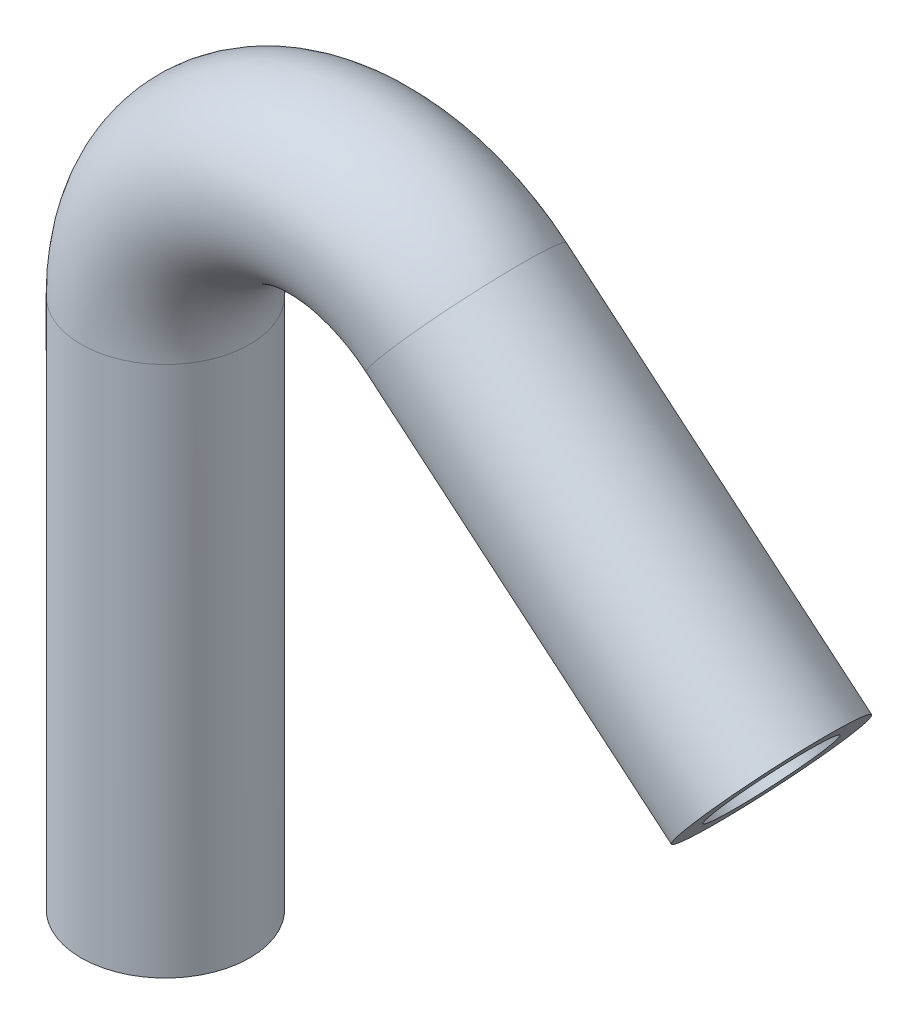
from build123d import *

# Parameters (mm, degrees)
SWEEP_SOTTILE1_PROFILE_R   = 3.175
SWEEP_SOTTILE1_PROFILE_R_2 = 2.175


with BuildPart() as part:
    # Sweep-Sottile1: sweep along a path in Schizzo1
    with BuildLine(Plane.XY) as sweep_sottile1_path:
        Line((0, 0), (0, 20))
        ThreePointArc((0, 20), (3.980067207, 26.247454091), (11.324232584, 25.280576377))
        Line((11.324232584, 25.280576377), (22.81489923, 15.638762231))
    # Sweep-Sottile1 profile (on start of the path) → Sweep-Sottile1 (sweep)
    with BuildSketch(Plane.ZX):
        Circle(SWEEP_SOTTILE1_PROFILE_R)
        Circle(SWEEP_SOTTILE1_PROFILE_R_2, mode=Mode.SUBTRACT)
    sweep(path=sweep_sottile1_path.line)


solid = part.part
